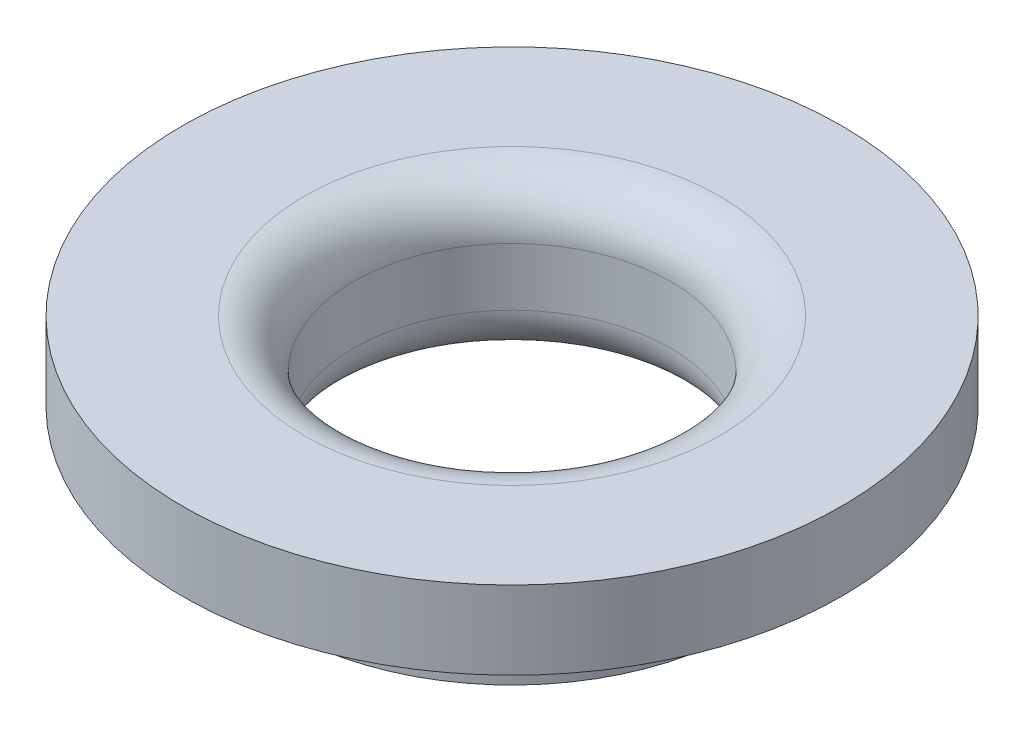
from build123d import *

# Parameters (mm, degrees)
FILLET1_R = 1


with BuildPart() as part:
    # Sketch2 → Revolve1 (revolve)
    with BuildSketch(Plane.XY, mode=Mode.PRIVATE) as revolve1_sk:
        Polygon((-6.699, 3.175), (-6.699, 1.5875), (-4.699, 1.5875), (-4.699, 0), (-3.22, 0), (-3.22, 3.175), align=None)
    revolve(revolve1_sk.sketch.rotate(Axis((0, 0, 0), (0, 1, 0)), 270), axis=Axis((0, 0, 0), (0, 1, 0)))

    # Fillet1
    fillet1_edges = [part.edges().sort_by_distance(p)[0] for p in [
        (0, 3.175, 3.22),
        (0, 0, 3.22),
    ]]
    fillet(fillet1_edges, radius=FILLET1_R)


solid = part.part
